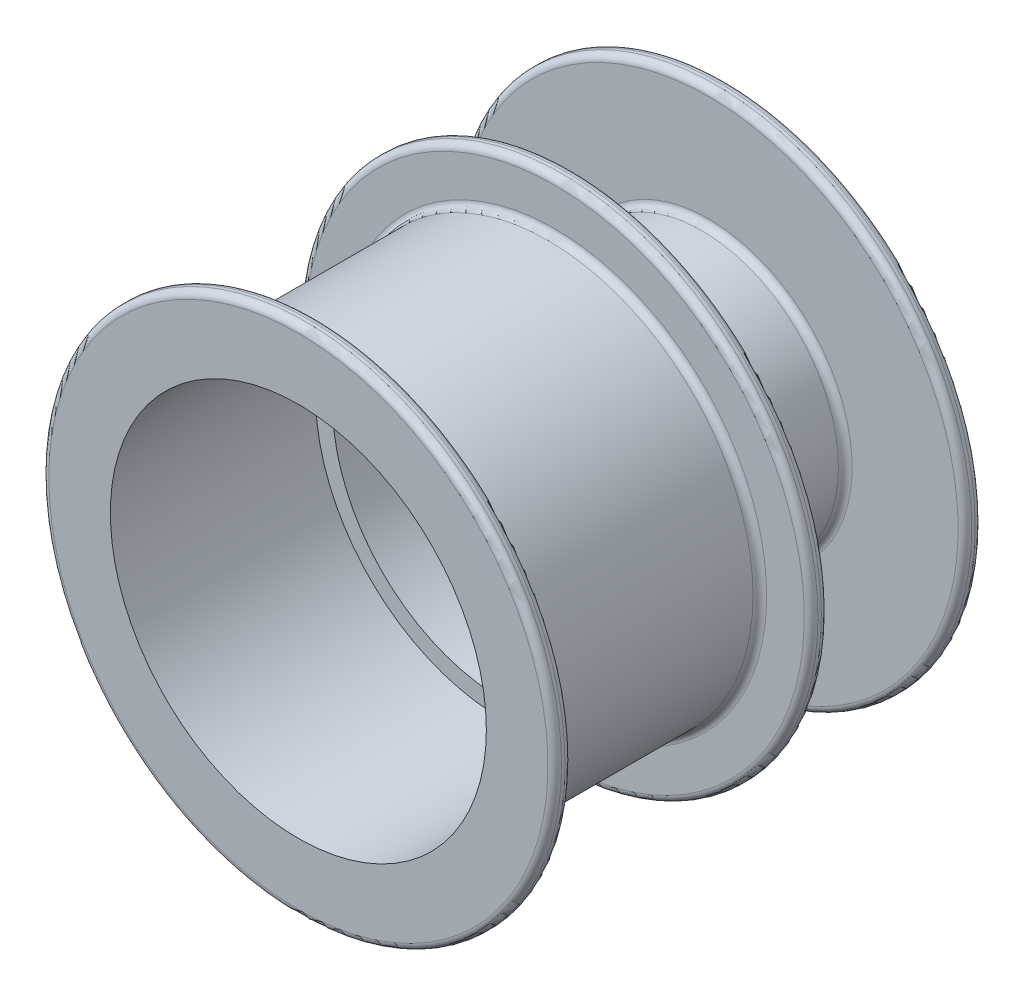
from build123d import *

# Parameters (mm, degrees)
FILLET1_R = 1.27
FILLET2_R = 1.27


with BuildPart() as part:
    # Sketch1 → Revolve1 (revolve)
    with BuildSketch(Plane(origin=(0, 0, 0), x_dir=(0, 0, -1), z_dir=(1, 0, 0)), mode=Mode.PRIVATE) as revolve1_sk:
        Polygon((0, 47.625), (0, 34.925), (38.1, 34.925), (38.1, 31.75), (47.625, 31.75), (47.625, 6.35), (55.118, 6.35), (55.118, 22.225), (79.375, 22.225), (79.375, 47.625), (76.2, 47.625), (76.2, 25.4), (50.8, 25.4), (50.8, 47.625), (47.625, 47.625), (47.625, 38.1), (3.175, 38.1), (3.175, 47.625), align=None)
    revolve(revolve1_sk.sketch.rotate(Axis((0, 0, 1.958452589), (0, 0, -1)), 90), axis=Axis((0, 0, 1.958452589), (0, 0, -1)))

    # Fillet1
    fillet1_edges = [part.edges().sort_by_distance(p)[0] for p in [
        (-47.625, 0, -3.175),
        (-47.625, 0, -47.625),
        (-47.625, 0, -50.8),
        (-47.625, 0, -76.2),
        (-47.625, 0, -79.375),
        (-47.625, 0, 0),
    ]]
    fillet(fillet1_edges, radius=FILLET1_R)

    # Fillet2
    fillet2_edges = [part.edges().sort_by_distance(p)[0] for p in [
        (-38.1, 0, -3.175),
        (-38.1, 0, -47.625),
        (-25.4, 0, -50.8),
        (-25.4, 0, -76.2),
    ]]
    fillet(fillet2_edges, radius=FILLET2_R)


solid = part.part
